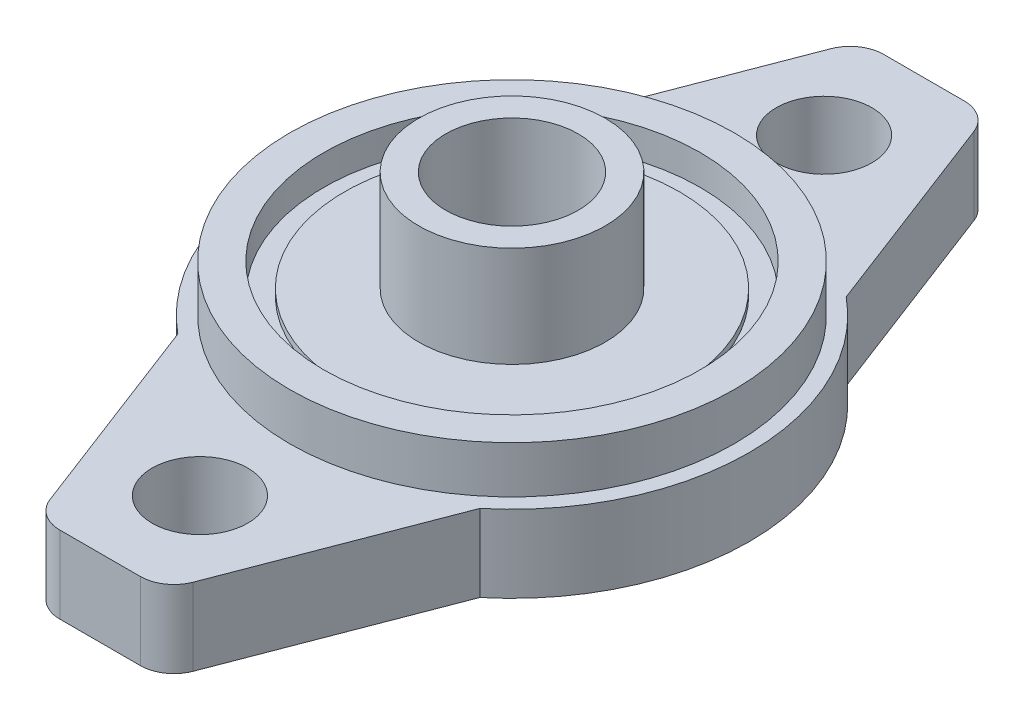
from build123d import *

# Parameters (mm, degrees)
SKETCH1_R           = 7.0612
SKETCH1_R_2         = 5.0165
BOSS_EXTRUDE1_DEPTH = 15.24
SKETCH2_R           = 12.66825
SKETCH2_R_2         = 7.0612
BOSS_EXTRUDE2_DEPTH = 7.62
SKETCH3_R           = 14.2494
SKETCH3_R_2         = 12.66825
BOSS_EXTRUDE3_DEPTH = 7.112
SKETCH4_R           = 16.8275
SKETCH4_R_2         = 14.2494
BOSS_EXTRUDE4_DEPTH = 9.398
SKETCH5_R           = 16.8275
BOSS_EXTRUDE5_DEPTH = 5.842
CUT_EXTRUDE1_REACH  = 39.194
SKETCH6_R           = 3.6195


with BuildPart() as part:
    # Sketch1 → Boss-Extrude1 (new body)
    with BuildSketch(Plane(origin=(0, 0, 0), x_dir=(1, 0, 0), z_dir=(0, 1, 0))):
        with Locations(Location((0, 0, 0), (0, 0, 90))):
            Circle(SKETCH1_R)
        with Locations(Location((0, 0, 0), (0, 0, 90))):
            Circle(SKETCH1_R_2, mode=Mode.SUBTRACT)
    extrude(amount=BOSS_EXTRUDE1_DEPTH)

    # Sketch2 → Boss-Extrude2 (add)
    with BuildSketch(Plane(origin=(0, 0, 0), x_dir=(1, 0, 0), z_dir=(0, 1, 0))):
        with Locations(Location((0, 0, 0), (0, 0, 90))):
            Circle(SKETCH2_R)
        with Locations(Location((0, 0, 0), (0, 0, 90))):
            Circle(SKETCH2_R_2, mode=Mode.SUBTRACT)
    extrude(amount=BOSS_EXTRUDE2_DEPTH)

    # Sketch3 → Boss-Extrude3 (add)
    with BuildSketch(Plane.XZ):
        with Locations(Location((0, 0, 0), (0, 0, 270))):
            Circle(SKETCH3_R)
        with Locations(Location((0, 0, 0), (0, 0, 270))):
            Circle(SKETCH3_R_2, mode=Mode.SUBTRACT)
    extrude(amount=-BOSS_EXTRUDE3_DEPTH)

    # Sketch4 → Boss-Extrude4 (add)
    with BuildSketch(Plane.XZ):
        with Locations(Location((0, 0, 0), (0, 0, 270))):
            Circle(SKETCH4_R)
        with Locations(Location((0, 0, 0), (0, 0, 270))):
            Circle(SKETCH4_R_2, mode=Mode.SUBTRACT)
    extrude(amount=-BOSS_EXTRUDE4_DEPTH)

    # Sketch5 → Boss-Extrude5 (add)
    with BuildSketch(Plane(origin=(0, 0, 0), x_dir=(1, 0, 0), z_dir=(0, 1, 0))):
        with BuildLine():
            ThreePointArc((-11.43, 13.867010141), (-17.9705, 0), (-11.43, -13.867010141))
            Line((-11.43, -13.867010141), (-5.419746982, -29.547574395))
            ThreePointArc((-5.419746982, -29.547574395), (-4.487192662, -30.731422474), (-3.048, -31.1785))
            Line((-3.048, -31.1785), (3.048, -31.1785))
            ThreePointArc((3.048, -31.1785), (4.487192662, -30.731422474), (5.419746982, -29.547574395))
            Line((5.419746982, -29.547574395), (11.43, -13.867010141))
            ThreePointArc((11.43, -13.867010141), (17.9705, 0), (11.43, 13.867010141))
            Line((11.43, 13.867010141), (5.419746982, 29.547574395))
            ThreePointArc((5.419746982, 29.547574395), (4.487192662, 30.731422474), (3.048, 31.1785))
            Line((3.048, 31.1785), (-3.048, 31.1785))
            ThreePointArc((-3.048, 31.1785), (-4.487192662, 30.731422474), (-5.419746982, 29.547574395))
            Line((-5.419746982, 29.547574395), (-11.43, 13.867010141))
        make_face()
        with Locations(Location((0, 0, 0), (0, 0, 90))):
            Circle(SKETCH5_R, mode=Mode.SUBTRACT)
    extrude(amount=BOSS_EXTRUDE5_DEPTH)

    # Sketch6 → Cut-Extrude1 (cut, up to next)
    with BuildSketch(Plane(origin=(0, 5.842, 0), x_dir=(1, 0, 0), z_dir=(0, 1, 0)), mode=Mode.PRIVATE) as cut_extrude1_sk1:
        with Locations(Location((0, 23.622, 0), (0, 0, 270))):
            Circle(SKETCH6_R)
    cut_extrude1_tool1 = extrude(cut_extrude1_sk1.sketch, amount=-CUT_EXTRUDE1_REACH, mode=Mode.PRIVATE) & part.part
    # Sketch6 → Cut-Extrude1 (cut, up to next)
    with BuildSketch(Plane(origin=(0, 5.842, 0), x_dir=(1, 0, 0), z_dir=(0, 1, 0)), mode=Mode.PRIVATE) as cut_extrude1_sk2:
        with Locations(Location((0, -23.622, 0), (0, 0, 270))):
            Circle(SKETCH6_R)
    cut_extrude1_tool2 = extrude(cut_extrude1_sk2.sketch, amount=-CUT_EXTRUDE1_REACH, mode=Mode.PRIVATE) & part.part
    add(cut_extrude1_tool1.solids().sort_by_distance((0, 5.842, -23.622))[0], mode=Mode.SUBTRACT)
    add(cut_extrude1_tool2.solids().sort_by_distance((0, 5.842, 23.622))[0], mode=Mode.SUBTRACT)


solid = part.part
